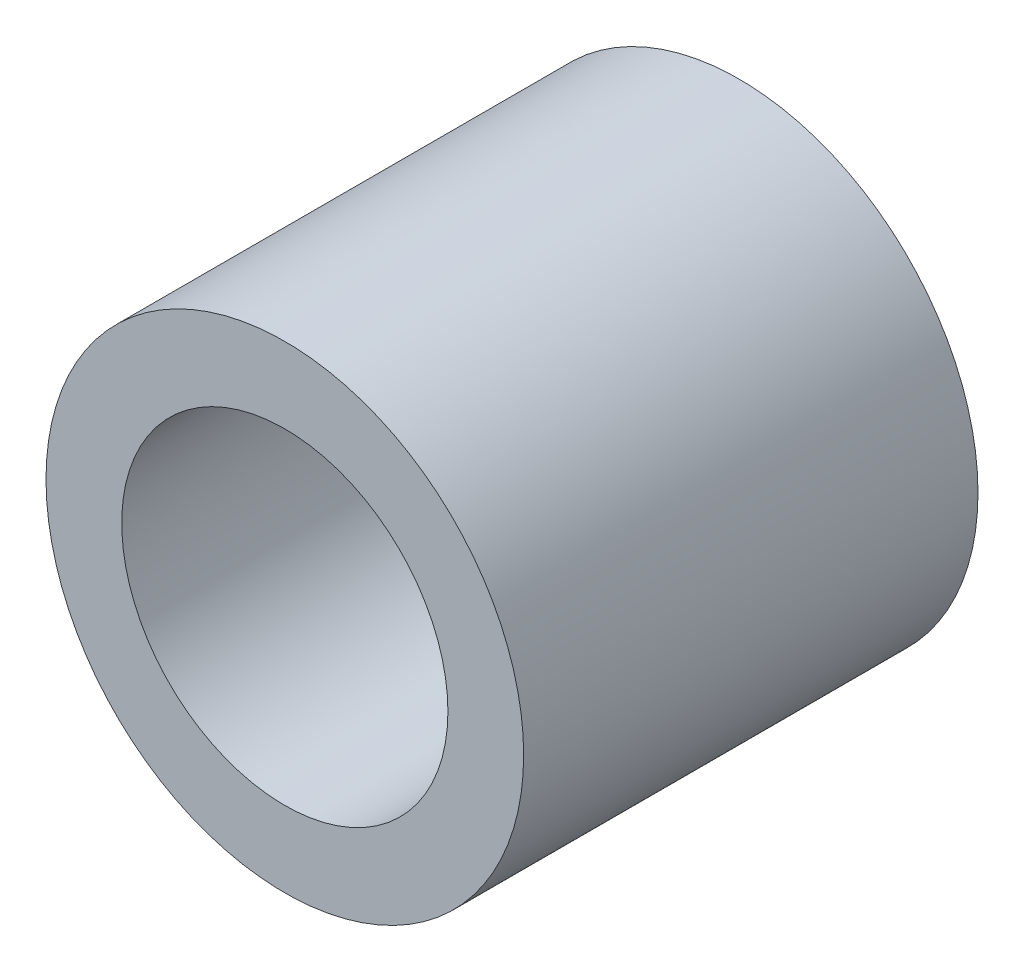
from build123d import *

# Parameters (mm, degrees)
SKETCH1_R           = 2.05
SKETCH1_R_2         = 1.4
BOSS_EXTRUDE1_DEPTH = 3.9


with BuildPart() as part:
    # Sketch1 → Boss-Extrude1 (new body)
    with BuildSketch(Plane.XY):
        Circle(SKETCH1_R)
        Circle(SKETCH1_R_2, mode=Mode.SUBTRACT)
    extrude(amount=BOSS_EXTRUDE1_DEPTH)


solid = part.part
